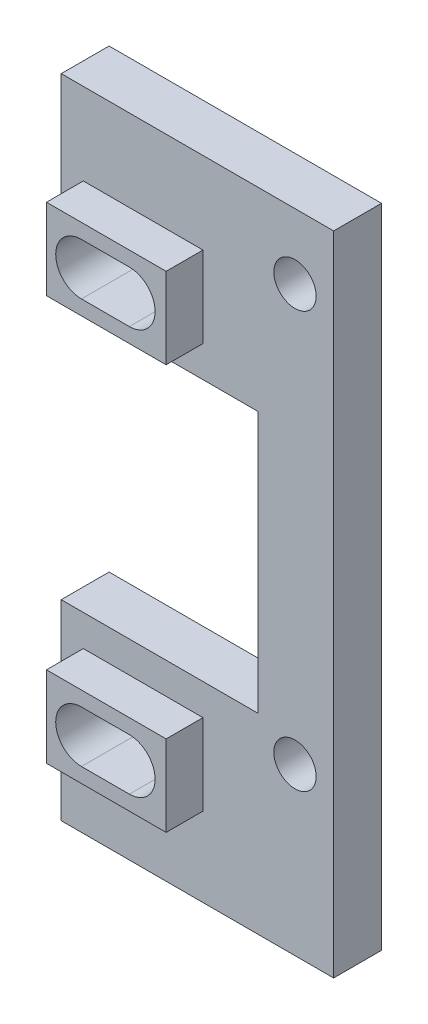
from build123d import *

# Parameters (mm, degrees)
PROFILE_R         = 1.15
EXTRUDE_248_DEPTH = 2.6
EXTRUDE_START     = 2.6
PROFILE_2_W       = 6.5
PROFILE_2_H       = 4.4
EXTRUDE_349_DEPTH = 2


with BuildPart() as part:
    # profile → Extrude 248 (new body)
    with BuildSketch(Plane.XY):
        Polygon((25.7, -32), (40.5, -32), (40.5, 3.15), (25.7, 3.15), (25.7, -7.4), (36.4, -7.4), (36.4, -21.6), (25.7, -21.6), align=None)
        with Locations((38.4, -23)):
            Circle(PROFILE_R, mode=Mode.SUBTRACT)
        with Locations((38.4, -0.4)):
            Circle(PROFILE_R, mode=Mode.SUBTRACT)
        with BuildLine():
            Line((28.8, -26.9), (31.4, -26.9))
            ThreePointArc((31.4, -26.9), (32.8, -25.5), (31.4, -24.1))
            Line((31.4, -24.1), (28.8, -24.1))
            ThreePointArc((28.8, -24.1), (27.4, -25.5), (28.8, -26.9))
        make_face(mode=Mode.SUBTRACT)
        with BuildLine():
            Line((28.8, -4.9), (31.4, -4.9))
            ThreePointArc((31.4, -4.9), (32.8, -3.5), (31.4, -2.1))
            Line((31.4, -2.1), (28.8, -2.1))
            ThreePointArc((28.8, -2.1), (27.4, -3.5), (28.8, -4.9))
        make_face(mode=Mode.SUBTRACT)
    extrude(amount=EXTRUDE_248_DEPTH)

    # profile 2 → Extrude 349 (add)
    # profile 1 of 2: a face of its own
    with BuildSketch(Plane.XY.offset(EXTRUDE_START)):
        with Locations((30.15, -25.5)):
            Rectangle(PROFILE_2_W, PROFILE_2_H)
        with BuildLine():
            Line((28.8, -26.9), (31.4, -26.9))
            ThreePointArc((31.4, -26.9), (32.8, -25.5), (31.4, -24.1))
            Line((31.4, -24.1), (28.8, -24.1))
            ThreePointArc((28.8, -24.1), (27.4, -25.5), (28.8, -26.9))
        make_face(mode=Mode.SUBTRACT)
    # profile 2 of 2: a face of its own
    with BuildSketch(Plane.XY.offset(EXTRUDE_START)):
        with Locations((30.15, -3.5)):
            Rectangle(PROFILE_2_W, PROFILE_2_H)
        with BuildLine():
            Line((28.8, -4.9), (31.4, -4.9))
            ThreePointArc((31.4, -4.9), (32.8, -3.5), (31.4, -2.1))
            Line((31.4, -2.1), (28.8, -2.1))
            ThreePointArc((28.8, -2.1), (27.4, -3.5), (28.8, -4.9))
        make_face(mode=Mode.SUBTRACT)
    extrude(amount=EXTRUDE_349_DEPTH)


solid = part.part
